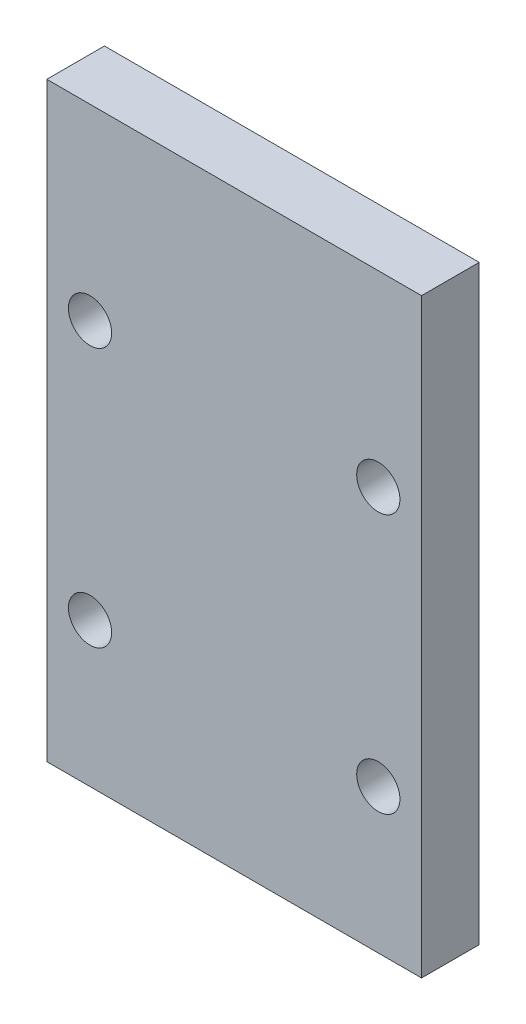
from build123d import *

# Parameters (mm, degrees)
SKETCH1_W           = 26
SKETCH1_H           = 41
SKETCH1_R           = 1.5
BOSS_EXTRUDE1_DEPTH = 4


with BuildPart() as part:
    # Sketch1 → Boss-Extrude1 (new body)
    with BuildSketch(Plane.XY):
        with Locations((13, 20.5)):
            Rectangle(SKETCH1_W, SKETCH1_H)
        with Locations((3, 28)):
            Circle(SKETCH1_R, mode=Mode.SUBTRACT)
        with Locations((3, 10)):
            Circle(SKETCH1_R, mode=Mode.SUBTRACT)
        with Locations(Location((23, 10, 0), (0, 0, 180))):
            Circle(SKETCH1_R, mode=Mode.SUBTRACT)
        with Locations(Location((23, 28, 0), (0, 0, 180))):
            Circle(SKETCH1_R, mode=Mode.SUBTRACT)
    extrude(amount=BOSS_EXTRUDE1_DEPTH)


solid = part.part
